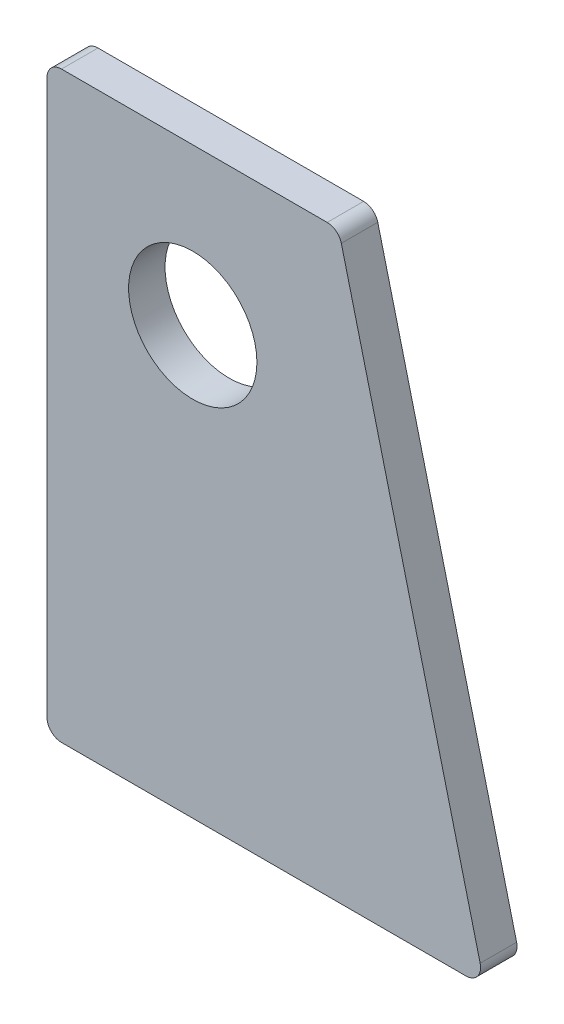
from build123d import *

# Parameters (mm, degrees)
SKETCH1_W           = 50.8
SKETCH1_H           = 101.6
SKETCH1_R           = 11.176
BOSS_EXTRUDE1_DEPTH = 6.35
FILLET1_R           = 2.54


with BuildPart() as part:
    # Sketch1 → Boss-Extrude1 (new body)
    # profile 1 of 2: a face of its own
    with BuildSketch(Plane.XY):
        with Locations((25.4, -50.8)):
            Rectangle(SKETCH1_W, SKETCH1_H)
        with Locations((25.4, -27.219704654)):
            Circle(SKETCH1_R, mode=Mode.SUBTRACT)
    # profile 2 of 2: a face of its own
    with BuildSketch(Plane.XY):
        Polygon((50.8, -101.6), (76.256220575, -101.6), (50.8, 0), align=None)
    extrude(amount=BOSS_EXTRUDE1_DEPTH)

    # Fillet1
    fillet1_edges = [part.edges().sort_by_distance(p)[0] for p in [
        (0, -101.6, 3.175),
        (0, 0, 3.175),
        (50.8, 0, 3.175),
        (76.256220575, -101.6, 3.175),
    ]]
    fillet(fillet1_edges, radius=FILLET1_R)


solid = part.part
